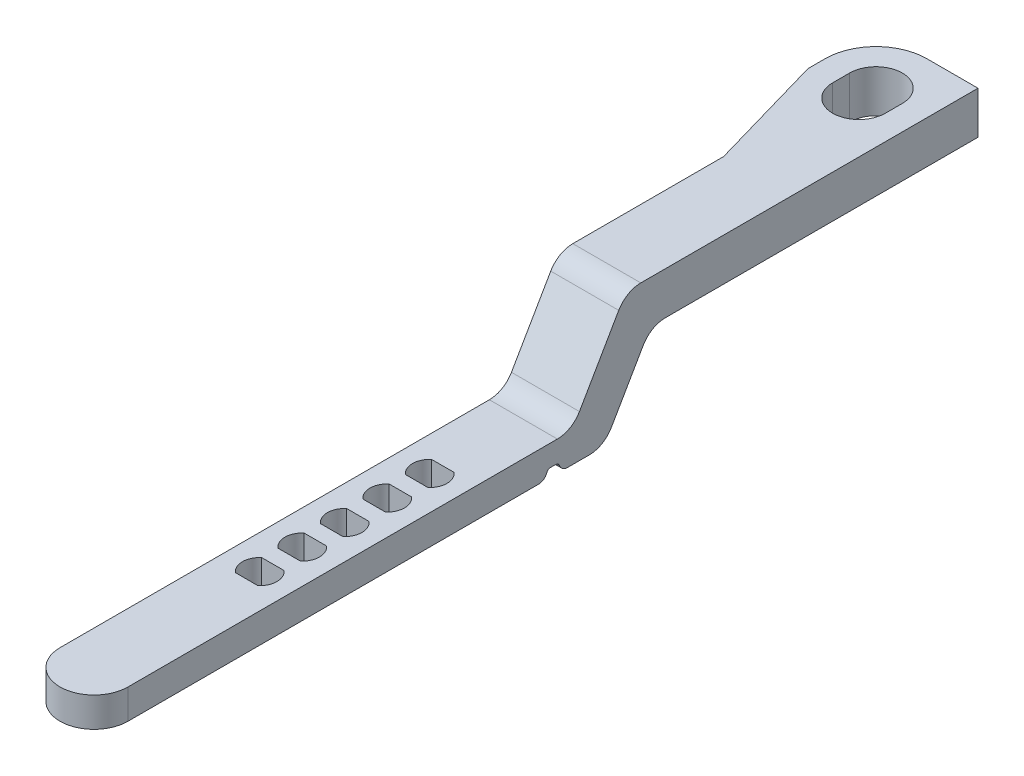
from build123d import *

# Parameters (mm, degrees)
SKETCH1_W                = 8
SKETCH1_H                = 3.5
BASE_DEPTH               = 50
SKETCH3_W                = 8
SKETCH3_H                = 3.5
SEGMENT1_DEPTH           = 50
BOSS_EXTRUDE7_DEPTH      = 3.5
BOSS_EXTRUDE9_DEPTH      = 11
CUT_EXTRUDE10_DEPTH      = 101.920760996
CUT_EXTRUDE10_DEPTH_BACK = 101.920760996
CUT_EXTRUDE9_DEPTH       = 102.52124162
CUT_EXTRUDE9_DEPTH_BACK  = 102.52124162
BOSS_EXTRUDE13_DEPTH     = 3.5
CUT_EXTRUDE12_DEPTH      = 10
CUT_EXTRUDE13_DEPTH      = 105.885652022
LPATTERN3_COUNT          = 5
LPATTERN3_PITCH          = 5
BOSS_EXTRUDE14_DEPTH     = 5
FILLET5_R                = 1


with BuildPart() as part:
    # Sketch1 → Base (new body)
    with BuildSketch(Plane.XY):
        Rectangle(SKETCH1_W, SKETCH1_H)
    extrude(amount=BASE_DEPTH)

    # Sketch3 → Segment1 (add)
    with BuildSketch(Plane(origin=(0, 0, 50), x_dir=(-1, 0, 0), z_dir=(0, 0, 1))):
        Rectangle(SKETCH3_W, SKETCH3_H)
    extrude(amount=SEGMENT1_DEPTH)

    # Sketch12 → Boss-Extrude7 (add)
    with BuildSketch(Plane(origin=(0, 1.75, 0), x_dir=(1, 0, 0), z_dir=(0, 1, 0))):
        Polygon((-4, 0), (-8, 0), (-8, -7), (-4, -21.92820323), align=None)
    extrude(amount=-BOSS_EXTRUDE7_DEPTH)

    # Sketch14 → Boss-Extrude9 (add)
    with BuildSketch(Plane(origin=(0, 1.75, 0), x_dir=(1, 0, 0), z_dir=(0, 1, 0))):
        with BuildLine():
            Line((4, -50), (4, -2))
            Line((4, -2), (0, 0))
            Line((0, 0), (-2, 0))
            ThreePointArc((-2, 0), (-6.242640687, -1.757359313), (-8, -6))
            Line((-8, -6), (-8, -8))
            Line((-8, -8), (-4, -21.92820323))
            Line((-4, -21.92820323), (-4, -50))
            Line((-4, -50), (4, -50))
        make_face()
        with BuildLine():
            ThreePointArc((-5.1, -6), (-2, -2.9), (1.1, -6))
            Line((1.1, -6), (1.1, -8))
            ThreePointArc((1.1, -8), (-2, -11.1), (-5.1, -8))
            Line((-5.1, -8), (-5.1, -6))
        make_face(mode=Mode.SUBTRACT)
    extrude(amount=BOSS_EXTRUDE9_DEPTH)

    # Sketch14<2> → Cut-Extrude10 (cut, two sides: drawn at the far end of the back side and taken through both)
    with BuildSketch(Plane(origin=(0, 1.75, 0), x_dir=(1, 0, 0), z_dir=(0, 1, 0)).offset(-CUT_EXTRUDE10_DEPTH_BACK)):
        Polygon((0, 0), (4, -2), (4, 0), align=None)
        with BuildLine():
            ThreePointArc((-8, -6), (-6.242640687, -1.757359313), (-2, 0))
            Line((-2, 0), (-8, 0))
            Line((-8, 0), (-8, -6))
        make_face()
        with BuildLine():
            ThreePointArc((1.1, -6), (-2, -2.9), (-5.1, -6))
            Line((-5.1, -6), (-5.1, -8))
            ThreePointArc((-5.1, -8), (-2, -11.1), (1.1, -8))
            Line((1.1, -8), (1.1, -6))
        make_face()
    extrude(amount=CUT_EXTRUDE10_DEPTH + CUT_EXTRUDE10_DEPTH_BACK, mode=Mode.SUBTRACT)

    # Sketch16 → Cut-Extrude9 (cut, two sides: drawn at the far end of the back side and taken through both)
    with BuildSketch(Plane(origin=(4, 0, 0), x_dir=(0, 0, -1), z_dir=(1, 0, 0)).offset(-CUT_EXTRUDE9_DEPTH_BACK)):
        with BuildLine():
            Line((-50, 12.75), (-50, 1.75))
            Line((-50, 1.75), (-49.484827557, 1.75))
            ThreePointArc((-49.484827557, 1.75), (-47.984827557, 2.151923789), (-46.886751346, 3.25))
            Line((-46.886751346, 3.25), (-42.267949192, 11.25))
            ThreePointArc((-42.267949192, 11.25), (-41.169872981, 12.348076211), (-39.669872981, 12.75))
            Line((-39.669872981, 12.75), (-50, 12.75))
        make_face()
        with BuildLine():
            ThreePointArc((-43.133974596, -0.25), (-44.232050808, -1.348076211), (-45.732050808, -1.75))
            Line((-45.732050808, -1.75), (0, -1.75))
            Line((0, -1.75), (0, 7.75))
            Line((0, 7.75), (-36.783121635, 7.75))
            ThreePointArc((-36.783121635, 7.75), (-38.283121635, 7.348076211), (-39.381197846, 6.25))
            Line((-39.381197846, 6.25), (-43.133974596, -0.25))
        make_face()
    extrude(amount=CUT_EXTRUDE9_DEPTH + CUT_EXTRUDE9_DEPTH_BACK, mode=Mode.SUBTRACT)

    # Sketch22 → Boss-Extrude13 (add)
    with BuildSketch(Plane(origin=(0, 1.75, 0), x_dir=(1, 0, 0), z_dir=(0, 1, 0))):
        with BuildLine():
            Line((-4, -100), (4, -100))
            ThreePointArc((4, -100), (0, -104), (-4, -100))
        make_face()
    extrude(amount=-BOSS_EXTRUDE13_DEPTH)

    # Sketch23 → Cut-Extrude12 (cut)
    with BuildSketch(Plane.ZY.offset(4)):
        with BuildLine():
            Line((49.698901561, -0.75), (50.270753554, -0.75))
            ThreePointArc((50.270753554, -0.75), (50.557541772, -0.840423978), (50.740599864, -1.078989928))
            Line((50.740599864, -1.078989928), (50.984827557, -1.75))
            Line((50.984827557, -1.75), (48.984827557, -1.75))
            Line((48.984827557, -1.75), (49.22905525, -1.078989928))
            ThreePointArc((49.22905525, -1.078989928), (49.412113342, -0.840423978), (49.698901561, -0.75))
        make_face()
    extrude(amount=-CUT_EXTRUDE12_DEPTH, mode=Mode.SUBTRACT)

    # Sketch24 → Cut-Extrude13 (cut, symmetric)
    with BuildSketch(Plane(origin=(0, 1.75, 0), x_dir=(1, 0, 0), z_dir=(0, 1, 0))):
        with BuildLine():
            Line((1.322611054, -58.96), (-1.322611054, -58.96))
            ThreePointArc((-1.322611054, -58.96), (-2.03, -60.5), (-1.322611054, -62.04))
            Line((-1.322611054, -62.04), (1.322611054, -62.04))
            ThreePointArc((1.322611054, -62.04), (1.844695156, -61.347348677), (2.03, -60.5))
            ThreePointArc((2.03, -60.5), (1.844695156, -59.652651323), (1.322611054, -58.96))
        make_face()
    cut_extrude13 = extrude(amount=CUT_EXTRUDE13_DEPTH, both=True, mode=Mode.SUBTRACT)

    # LPattern3: Cut-Extrude13 ×5
    with Locations(*[(0, 0, i * LPATTERN3_PITCH) for i in range(1, LPATTERN3_COUNT)]):
        add(cut_extrude13, mode=Mode.SUBTRACT)

    # Sketch25 → Boss-Extrude14 (add)
    with BuildSketch(Plane(origin=(0, 12.75, 0), x_dir=(1, 0, 0), z_dir=(0, 1, 0))):
        Polygon((4, -2), (4, 0), (0, 0), align=None)
    extrude(amount=-BOSS_EXTRUDE14_DEPTH)

    # Fillet5
    fillet5_edges = [part.edges().sort_by_distance(p)[0] for p in [
        (0, -1.75, 50.984827557),
        (0, -1.75, 48.984827557),
    ]]
    fillet(fillet5_edges, radius=FILLET5_R)


solid = part.part
